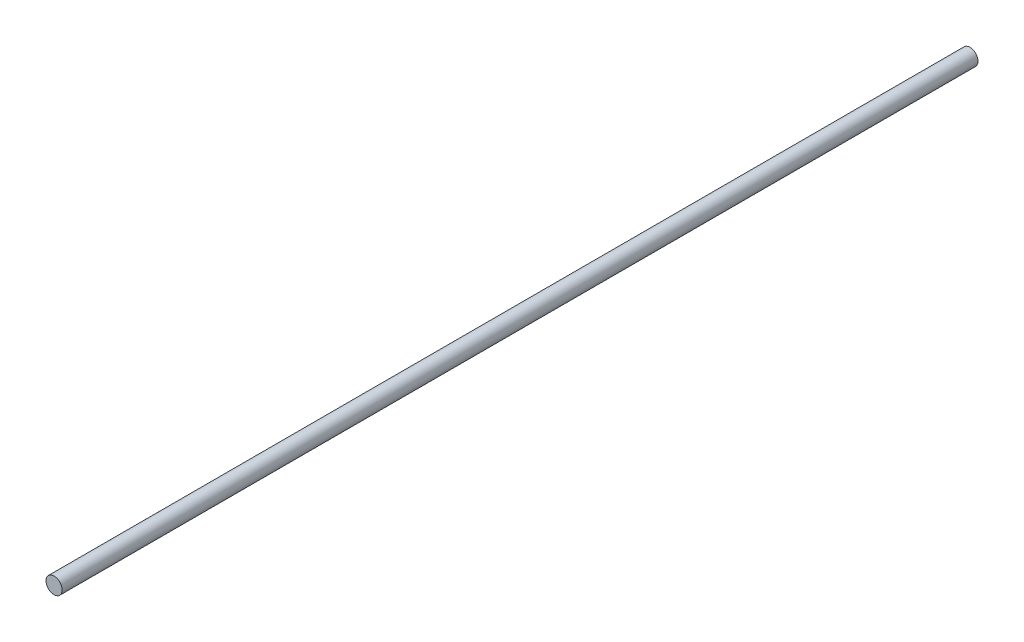
from build123d import *

# Parameters (mm, degrees)
ESQUISSE1_R        = 7.5
BOSS_EXTRU_1_DEPTH = 850


with BuildPart() as part:
    # Esquisse1 → Boss.-Extru.1 (new body)
    with BuildSketch(Plane.XY):
        Circle(ESQUISSE1_R)
    extrude(amount=BOSS_EXTRU_1_DEPTH)


solid = part.part
